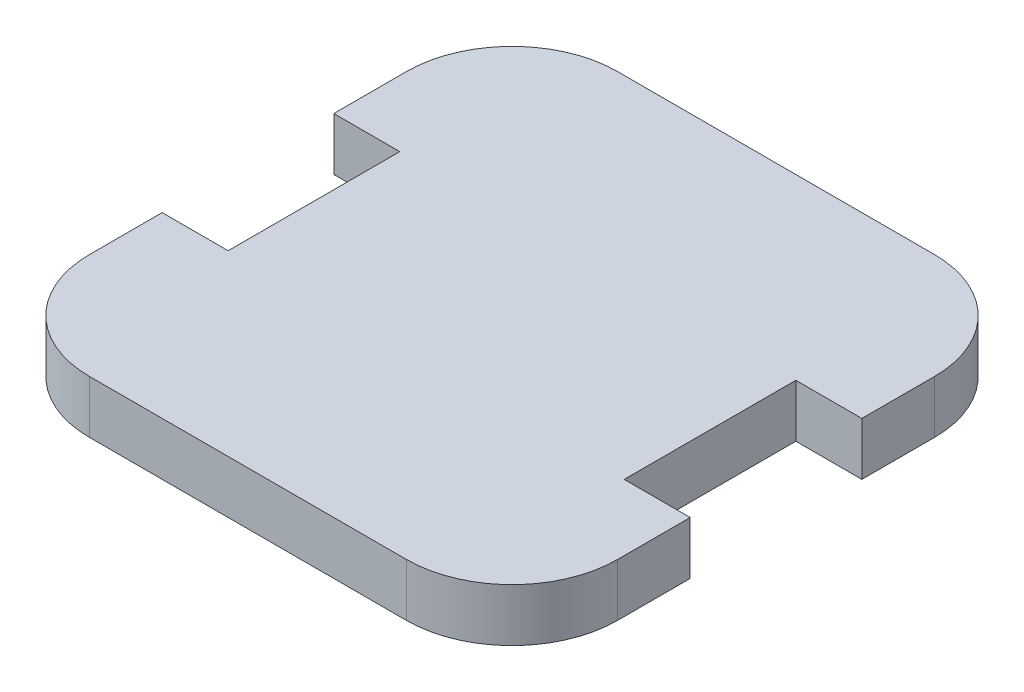
from build123d import *

# Parameters (mm, degrees)
SKETCH1_W           = 50.8
SKETCH1_H           = 50.8
BOSS_EXTRUDE1_DEPTH = 5.08
FILLET1_R           = 10.16
SKETCH2_W           = 6.35
SKETCH2_H           = 16.51
CUT_EXTRUDE1_DEPTH  = 5.08


with BuildPart() as part:
    # Sketch1 → Boss-Extrude1 (new body)
    with BuildSketch(Plane(origin=(0, 0, 0), x_dir=(1, 0, 0), z_dir=(0, 1, 0))):
        Rectangle(SKETCH1_W, SKETCH1_H)
    extrude(amount=BOSS_EXTRUDE1_DEPTH)

    # Fillet1
    fillet1_edges = [part.edges().sort_by_distance(p)[0] for p in [
        (25.4, 2.54, 25.4),
        (-25.4, 2.54, 25.4),
        (-25.4, 2.54, -25.4),
        (25.4, 2.54, -25.4),
    ]]
    fillet(fillet1_edges, radius=FILLET1_R)

    # Sketch2 → Cut-Extrude1 (cut)
    with BuildSketch(Plane(origin=(0, 5.08, 0), x_dir=(1, 0, 0), z_dir=(0, 1, 0))):
        with Locations((22.225, 0)):
            Rectangle(SKETCH2_W, SKETCH2_H)
    cut_extrude1 = extrude(amount=-CUT_EXTRUDE1_DEPTH, mode=Mode.SUBTRACT)

    # Mirror1: Cut-Extrude1 across plane
    add(cut_extrude1.mirror(Plane(origin=(0, 0, 0), x_dir=(0, 0, 1), z_dir=(1, 0, 0))), mode=Mode.SUBTRACT)


solid = part.part
